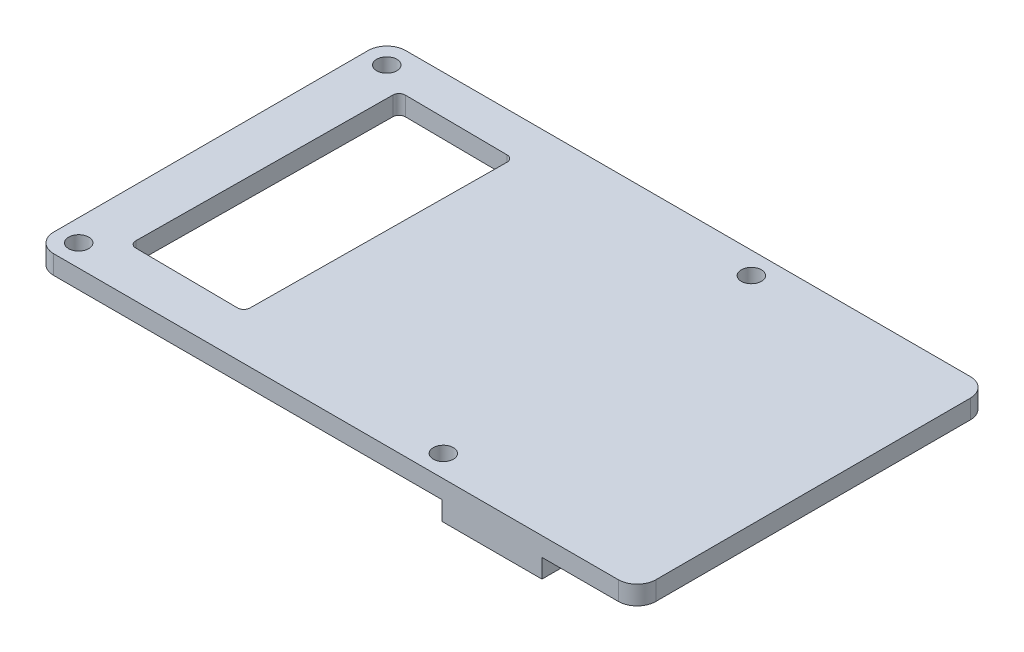
from build123d import *

# Parameters (mm, degrees)
SKETCH_1_R      = 1.6
EXTRUDE_1_DEPTH = 3
SKETCH_3_W      = 15.866394843
SKETCH_3_H      = 55.981711963
SKETCH_3_W_2    = 12.02170443
SKETCH_3_H_2    = 38.866282165
EXTRUDE_3_DEPTH = 3


with BuildPart() as part:
    # 草图1 → 凸台-拉伸1 (new body)
    with BuildSketch(Plane(origin=(0, 0, 0), x_dir=(1, 0, 0), z_dir=(0, 1, 0))):
        with BuildLine():
            Line((-80.009028181, 21.402670377), (-80.009028181, -28.604431477))
            ThreePointArc((-80.009028181, -28.604431477), (-79.134066788, -30.716775138), (-77.021723127, -31.591736531))
            Line((-77.021723127, -31.591736531), (12.787258331, -31.591736531))
            ThreePointArc((12.787258331, -31.591736531), (14.899601993, -30.716775138), (15.774563386, -28.604431477))
            Line((15.774563386, -28.604431477), (15.774563386, 21.402670377))
            ThreePointArc((15.774563386, 21.402670377), (14.899601993, 23.515014039), (12.787258331, 24.389975432))
            Line((12.787258331, 24.389975432), (-77.021723127, 24.389975432))
            ThreePointArc((-77.021723127, 24.389975432), (-79.134066788, 23.515014039), (-80.009028181, 21.402670377))
        make_face()
        with Locations(Location((-76.52848462, 20.886724226, 0), (0, 0, 270))):
            Circle(SKETCH_1_R, mode=Mode.SUBTRACT)
        with Locations(Location((-18.52858622, 20.886597225, 0), (0, 0, 270))):
            Circle(SKETCH_1_R, mode=Mode.SUBTRACT)
        with Locations(Location((-18.52833222, -28.113656775, 0), (0, 0, 270))):
            Circle(SKETCH_1_R, mode=Mode.SUBTRACT)
        with Locations(Location((-76.52833222, -28.113529775, 0), (0, 0, 270))):
            Circle(SKETCH_1_R, mode=Mode.SUBTRACT)
        with BuildLine():
            Line((-70.903401709, 18.230282987), (-54.564490165, 18.082300473))
            ThreePointArc((-54.564490165, 18.082300473), (-53.860065027, 17.78301522), (-53.573587867, 17.073284796))
            Line((-53.573587867, 17.073284796), (-53.940568984, -23.445502526))
            ThreePointArc((-53.940568984, -23.445502526), (-54.239854236, -24.149927664), (-54.94958466, -24.436404824))
            Line((-54.94958466, -24.436404824), (-71.288496204, -24.288422311))
            ThreePointArc((-71.288496204, -24.288422311), (-71.992921342, -23.989137058), (-72.279398502, -23.279406634))
            Line((-72.279398502, -23.279406634), (-71.912417386, 17.239380688))
            ThreePointArc((-71.912417386, 17.239380688), (-71.613132133, 17.943805826), (-70.903401709, 18.230282987))
        make_face(mode=Mode.SUBTRACT)
    extrude(amount=EXTRUDE_1_DEPTH)

    # 草图3 → 凸台-拉伸3 (add)
    with BuildSketch(Plane.XZ):
        with Locations((-7.293882236, 3.60088055)):
            Rectangle(SKETCH_3_W, SKETCH_3_H)
        with Locations((-30.854956036, 3.919082923)):
            Rectangle(SKETCH_3_W_2, SKETCH_3_H_2)
    extrude(amount=EXTRUDE_3_DEPTH)


solid = part.part
